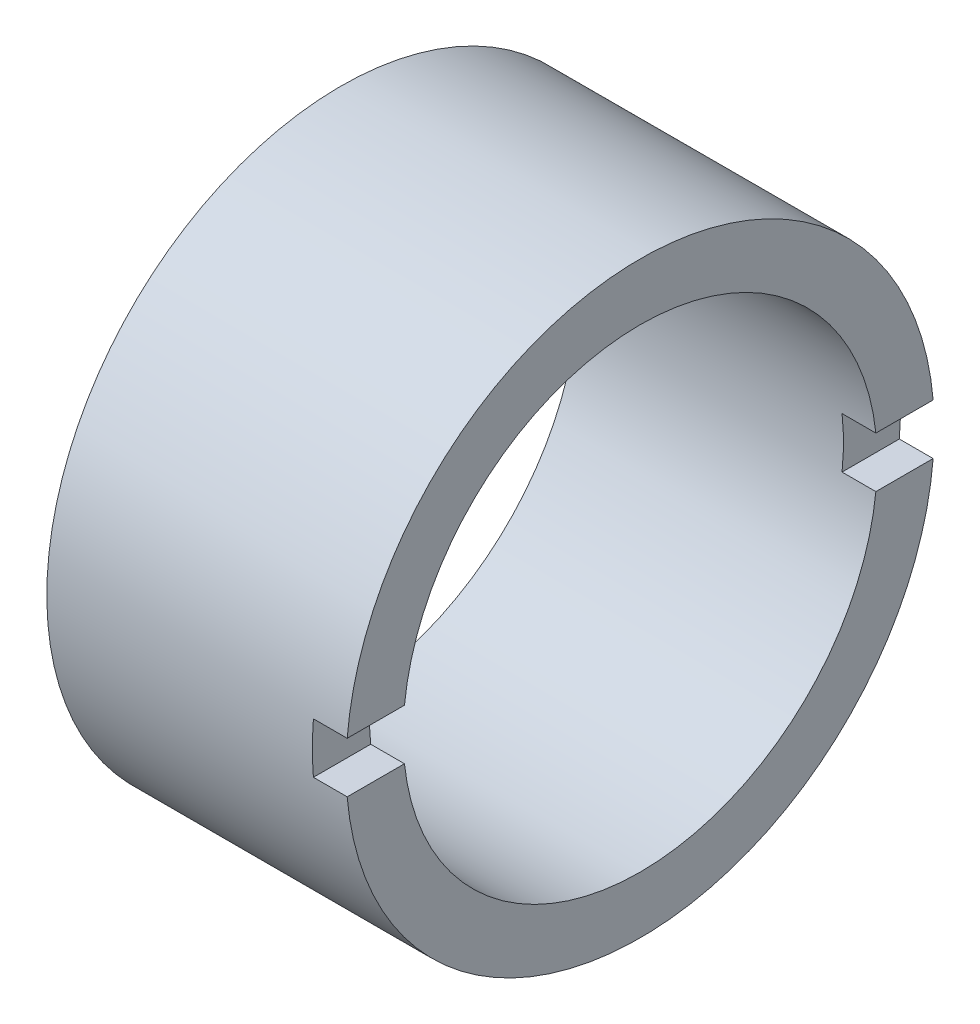
from build123d import *

# Parameters (mm, degrees)
SKETCH2_R               = 26.5303
SKETCH2_R_2             = 21.3868
BOSS_EXTRUDE1_DEPTH     = 27.0002
CUT_EXTRUDE1_DEPTH      = 47.224716724
CUT_EXTRUDE1_DEPTH_BACK = 47.224716724
SKETCH3_W               = 3.048
SKETCH3_H               = 4.572


with BuildPart() as part:
    # Sketch2 → Boss-Extrude1 (new body)
    with BuildSketch(Plane(origin=(0, 0, 0), x_dir=(0, 0, -1), z_dir=(1, 0, 0))):
        Circle(SKETCH2_R)
        Circle(SKETCH2_R_2, mode=Mode.SUBTRACT)
    extrude(amount=BOSS_EXTRUDE1_DEPTH)

    # Sketch3 → Cut-Extrude1 (cut, two sides: drawn at the far end of the back side and taken through both)
    with BuildSketch(Plane.XY.offset(-CUT_EXTRUDE1_DEPTH_BACK)):
        with Locations((25.4762, 0)):
            Rectangle(SKETCH3_W, SKETCH3_H)
    extrude(amount=CUT_EXTRUDE1_DEPTH + CUT_EXTRUDE1_DEPTH_BACK, mode=Mode.SUBTRACT)


solid = part.part
